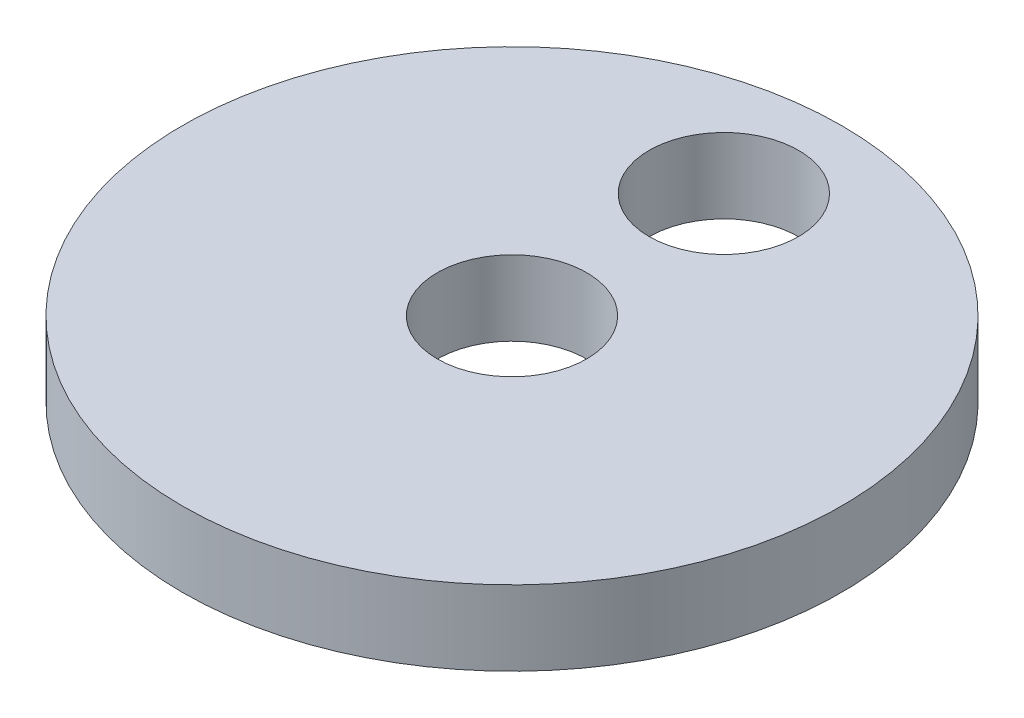
from build123d import *

# Parameters (mm, degrees)
SKETCH1_R           = 14
BOSS_EXTRUDE1_DEPTH = 3.18
SKETCH2_R           = 3.175
CUT_EXTRUDE1_DEPTH  = 21.052740461
SKETCH3_R           = 3.175
CUT_EXTRUDE2_DEPTH  = 21.052740461


with BuildPart() as part:
    # Sketch1 → Boss-Extrude1 (new body)
    with BuildSketch(Plane(origin=(0, 0, 0), x_dir=(1, 0, 0), z_dir=(0, 1, 0))):
        with Locations(Location((0, 0, 0), (0, 0, 90))):
            Circle(SKETCH1_R)
    extrude(amount=BOSS_EXTRUDE1_DEPTH)

    # Sketch2 → Cut-Extrude1 (cut, through all)
    with BuildSketch(Plane(origin=(0, 3.18, 0), x_dir=(1, 0, 0), z_dir=(0, 1, 0))):
        with Locations(Location((0, 0, 0), (0, 0, 270))):
            Circle(SKETCH2_R)
    extrude(amount=-CUT_EXTRUDE1_DEPTH, mode=Mode.SUBTRACT)

    # Sketch3 → Cut-Extrude2 (cut, through all)
    with BuildSketch(Plane(origin=(0, 3.18, 0), x_dir=(1, 0, 0), z_dir=(0, 1, 0))):
        with Locations(Location((0, 9, 0), (0, 0, 270))):
            Circle(SKETCH3_R)
    extrude(amount=-CUT_EXTRUDE2_DEPTH, mode=Mode.SUBTRACT)


solid = part.part
